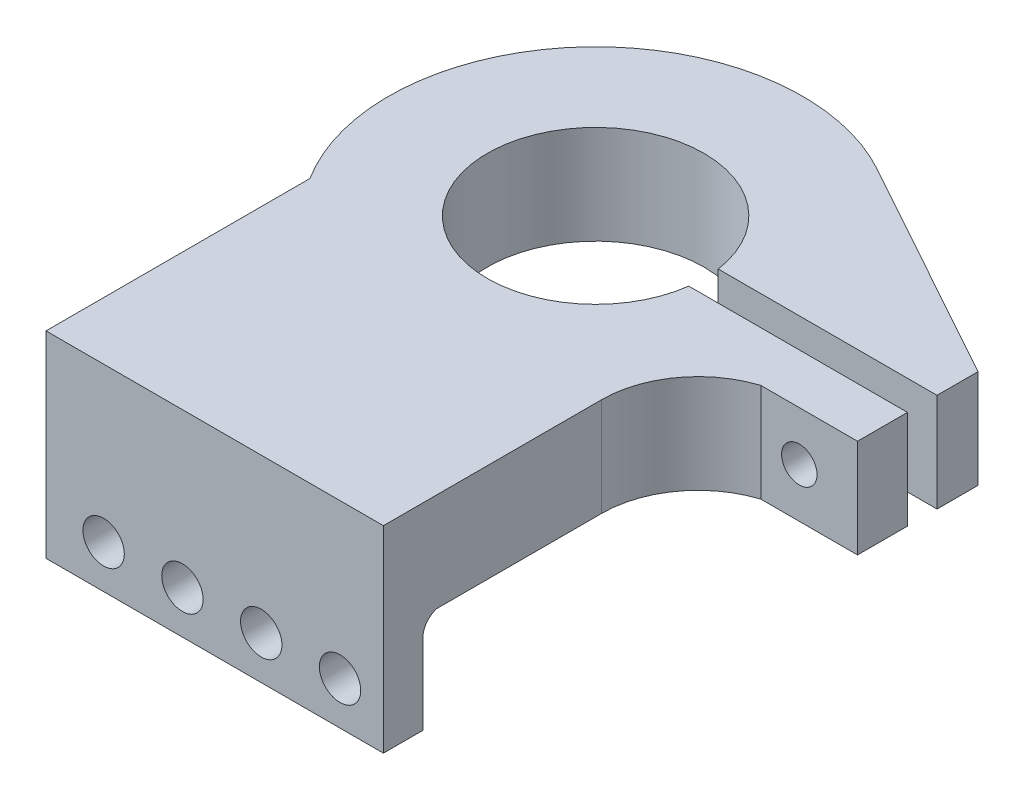
from build123d import *

# Parameters (mm, degrees)
SKETCH_1_R                       = 27
SKETCH_1_R_2                     = 11
EXTRUDE_1_DEPTH                  = 10
SKETCH_2_W                       = 22.095017754
SKETCH_2_H                       = 3
CUT_EXTRUDE_5_DEPTH              = 10
EXTRUDE_6_DEPTH                  = 10
EXTRUDE_7_DEPTH                  = 10
SKETCH_5_W                       = 10
SKETCH_5_H                       = 31.875888506
CUT_EXTRUDE_6_DEPTH              = 10
EXTRUDE_8_DEPTH                  = 10
SKETCH_7_R                       = 1.8
CUT_EXTRUDE_7_DEPTH              = 25
SKETCH_9_R                       = 3
CUT_EXTRUDE_8_DEPTH              = 25
SKETCH_10_R                      = 3
SKETCH_10_R_2                    = 1.8
EXTRUDE_9_DEPTH                  = 10
SKETCH_11_W                      = 6.352022703
SKETCH_11_H                      = 3
CUT_EXTRUDE_9_DEPTH              = 10
CUT_EXTRUDE_START                = -10
CUT_EXTRUDE_11_DEPTH             = 10
SKETCH_19_W                      = 12.590596853
SKETCH_19_H                      = 36.443103769
EXTRUDE_10_DEPTH                 = 10
CUT_EXTRUDE_16_DEPTH             = 45.4
SKETCH_23_W                      = 4
SKETCH_23_H                      = 10
EXTRUDE_14_DEPTH                 = 45.5
CUT_EXTRUDE_17_DEPTH             = 45.5
EXTRUDE_15_DEPTH                 = 45.5
SKETCH_26_W                      = 0.328740034
SKETCH_26_H                      = 1.346185816
CUT_EXTRUDE_18_DEPTH             = 45.5
SKETCH_28_R                      = 2.5
CUT_EXTRUDE_19_DEPTH             = 45.5
SKETCH_30_R                      = 1.8
CUT_EXTRUDE_21_DEPTH             = 45.5
SKETCH_31_R                      = 2.5
EXTRUDE_16_DEPTH                 = 10
CUT_EXTRUDE_23_DEPTH             = 10
CUT_EXTRUDE_23_DEPTH_BACK        = 10
CUT_EXTRUDE_24_DEPTH             = 10
CUT_EXTRUDE_25_DEPTH             = 10
SKETCH_35_R                      = 2.5
CUT_EXTRUDE_26_DEPTH             = 10
CUT_EXTRUDE_28_REACH             = 55.82
CUT_EXTRUDE_28_DIRECTION_2_DEPTH = 10
EXTRUDE_17_DEPTH                 = 10
EXTRUDE_18_DEPTH                 = 35
SKETCH_41_W                      = 10.589604426
SKETCH_41_H                      = 19.03102185
CUT_EXTRUDE_29_DEPTH             = 8
EXTRUDE_19_DEPTH                 = 10
CUT_EXTRUDE_30_DEPTH             = 10
SKETCH_44_W                      = 12.06182449
SKETCH_44_H                      = 13.548079332
CUT_EXTRUDE_31_DEPTH             = 10
EXTRUDE_20_DEPTH                 = 10
SKETCH_46_R                      = 1.8
CUT_EXTRUDE_33_DEPTH             = 27
SKETCH_48_R                      = 4
CUT_EXTRUDE_34_DEPTH             = 27
SKETCH_49_W                      = 13.336731655
SKETCH_49_H                      = 10
EXTRUDE_21_DEPTH                 = 2
CUT_EXTRUDE_35_DEPTH             = 14
SKETCH_53_R                      = 4
SKETCH_53_R_2                    = 1.8
EXTRUDE_22_DEPTH                 = 4
SKETCH_54_W                      = 11.097852062
SKETCH_54_H                      = 3
CUT_EXTRUDE_36_DEPTH             = 11
SKETCH_55_R                      = 1.8
CUT_EXTRUDE_37_DEPTH             = 10
SKETCH_56_R                      = 2.5
EXTRUDE_23_DEPTH                 = 0.5
SKETCH_57_R                      = 2.1
CUT_EXTRUDE_38_DEPTH             = 10


with BuildPart() as part:
    # 草圖1 → 填料-伸長1 (new body)
    with BuildSketch(Plane(origin=(0, 0, 0), x_dir=(1, 0, 0), z_dir=(0, 1, 0))):
        with Locations(Location((0, 0, 0), (0, 0, 270))):
            Circle(SKETCH_1_R)
        with Locations(Location((0, 0, 0), (0, 0, 270))):
            Circle(SKETCH_1_R_2, mode=Mode.SUBTRACT)
    extrude(amount=EXTRUDE_1_DEPTH)

    # 草圖2 → 除料-伸長5 (cut)
    with BuildSketch(Plane(origin=(0, 10, 0), x_dir=(1, 0, 0), z_dir=(0, 1, 0))):
        with Locations((19.801751301, 0.053075405)):
            Rectangle(SKETCH_2_W, SKETCH_2_H)
    extrude(amount=-CUT_EXTRUDE_5_DEPTH, mode=Mode.SUBTRACT)

    # 草圖3 → 填料-伸長6 (add)
    with BuildSketch(Plane(origin=(0, 10, 0), x_dir=(1, 0, 0), z_dir=(0, 1, 0))):
        Polygon((26.955295524, 1.553075405), (36.774942479, 1.553075405), (36.774942479, 6.233042813), (16.156778885, 21.632348371), align=None)
    extrude(amount=-EXTRUDE_6_DEPTH)

    # 草圖4 → 填料-伸長7 (add)
    with BuildSketch(Plane(origin=(0, 10, 0), x_dir=(1, 0, 0), z_dir=(0, 1, 0))):
        Polygon((26.961201925, -1.446924595), (36.771201925, -1.446924595), (36.771201925, -38.002813101), (-26.958798075, -38.002813101), (-27, 0), (-10.999869528, -0.053575877), (-10.999869528, -22.141468438), (17.239278233, -20.779973195), align=None)
    extrude(amount=-EXTRUDE_7_DEPTH)

    # 草圖5 → 除料-伸長6 (cut)
    with BuildSketch(Plane(origin=(0, 10, 0), x_dir=(1, 0, 0), z_dir=(0, 1, 0))):
        with Locations((31.771201925, -22.064868848)):
            Rectangle(SKETCH_5_W, SKETCH_5_H)
    extrude(amount=-CUT_EXTRUDE_6_DEPTH, mode=Mode.SUBTRACT)

    # 草圖6 → 填料-伸長8 (add)
    with BuildSketch(Plane(origin=(0, 10, 0), x_dir=(1, 0, 0), z_dir=(0, 1, 0))):
        with BuildLine():
            Line((28.570335935, -6.126924595), (26.771201925, -6.126924595))
            Line((26.771201925, -6.126924595), (26.771201925, -8.915002743))
            ThreePointArc((26.771201925, -8.915002743), (27.260031865, -7.255916929), (28.570335935, -6.126924595))
        make_face()
    extrude(amount=-EXTRUDE_8_DEPTH)

    # 草圖7 → 除料-伸長7 (cut)
    with BuildSketch(Plane.XY.offset(6.126924595)):
        with Locations((31.771201925, 5)):
            Circle(SKETCH_7_R)
    extrude(amount=-CUT_EXTRUDE_7_DEPTH, mode=Mode.SUBTRACT)

    # 草圖9 → 除料-伸長8 (cut)
    with BuildSketch(Plane.XY.offset(6.126924595)):
        with Locations((31.771201925, 5)):
            Circle(SKETCH_9_R)
    extrude(amount=-CUT_EXTRUDE_8_DEPTH, mode=Mode.SUBTRACT)

    # 草圖10 → 填料-伸長9 (add)
    with BuildSketch(Plane.XY.offset(6.126924595)):
        with Locations((31.771201925, 5)):
            Circle(SKETCH_10_R)
        with Locations((31.771201925, 5)):
            Circle(SKETCH_10_R_2, mode=Mode.SUBTRACT)
    extrude(amount=-EXTRUDE_9_DEPTH)

    # 草圖11 → 除料-伸長9 (cut)
    with BuildSketch(Plane(origin=(0, 10, 0), x_dir=(1, 0, 0), z_dir=(0, 1, 0))):
        with Locations((31.710814777, 0.053075405)):
            Rectangle(SKETCH_11_W, SKETCH_11_H)
    extrude(amount=-CUT_EXTRUDE_9_DEPTH, mode=Mode.SUBTRACT)

    # 草圖12 → 除料-伸長11 (cut)
    with BuildSketch(Plane(origin=(0, 10, 0), x_dir=(1, 0, 0), z_dir=(0, 1, 0)).offset(CUT_EXTRUDE_START)):
        with BuildLine():
            Line((-26.958798075, -1.916110557), (-26.958798075, -38.002813101))
            Line((-26.958798075, -38.002813101), (-22.958798075, -38.002813101))
            Line((-22.958798075, -38.002813101), (-22.958798075, -14.208926452))
            ThreePointArc((-22.958798075, -14.208926452), (-25.691425872, -8.303652008), (-26.931923814, -1.916110557))
            Line((-26.931923814, -1.916110557), (-26.958798075, -1.916110557))
        make_face()
    extrude(amount=CUT_EXTRUDE_11_DEPTH, mode=Mode.SUBTRACT)

    # 草圖19 → 填料-伸長10 (add)
    with BuildSketch(Plane(origin=(0, 10, 0), x_dir=(1, 0, 0), z_dir=(0, 1, 0))):
        with Locations((-20.703010567, -19.781261216)):
            Rectangle(SKETCH_19_W, SKETCH_19_H)
    extrude(amount=-EXTRUDE_10_DEPTH)

    # 草圖20 → 除料-伸長16 (cut)
    with BuildSketch(Plane(origin=(0, 10, 0), x_dir=(1, 0, 0), z_dir=(0, 1, 0))):
        with BuildLine():
            Line((-29.650037287, -38.002813101), (-26.998308993, -38.002813101))
            Line((-26.998308993, -38.002813101), (-26.998308993, -1.559709332))
            Line((-26.998308993, -1.559709332), (-26.999389481, -0.563115103))
            ThreePointArc((-26.999389481, -0.563115103), (-27.003472798, -0.310785854), (-27.005197962, -0.058429465))
            Line((-27.005197962, -0.058429465), (-29.650037287, 0))
            Line((-29.650037287, 0), (-29.650037287, -38.002813101))
        make_face()
        with BuildLine():
            Line((-26.998308993, -38.002813101), (-18.650037287, -38.002813101))
            Line((-18.650037287, -38.002813101), (-18.650037287, -19.531007147))
            ThreePointArc((-18.650037287, -19.531007147), (-24.716649717, -10.87986019), (-26.999389481, -0.563115103))
            Line((-26.999389481, -0.563115103), (-26.998308993, -1.559709332))
            Line((-26.998308993, -1.559709332), (-26.998308993, -38.002813101))
        make_face()
    extrude(amount=-CUT_EXTRUDE_16_DEPTH, mode=Mode.SUBTRACT)

    # 草圖23 → 填料-伸長14 (add)
    with BuildSketch(Plane(origin=(26.771201925, 0, 0), x_dir=(0, 0, -1), z_dir=(1, 0, 0))):
        with Locations((-36.002813101, -5)):
            Rectangle(SKETCH_23_W, SKETCH_23_H)
    extrude(amount=-EXTRUDE_14_DEPTH)

    # 草圖24 → 除料-伸長17 (cut)
    with BuildSketch(Plane(origin=(0, 10, 0), x_dir=(1, 0, 0), z_dir=(0, 1, 0))):
        with BuildLine():
            Line((-22.875040088, -38.002813101), (-18.650037287, -38.002813101))
            Line((-18.650037287, -38.002813101), (-18.650037287, -19.531007147))
            ThreePointArc((-18.650037287, -19.531007147), (-19.783571885, -18.381904538), (-20.846430488, -17.167133333))
            Line((-20.846430488, -17.167133333), (-22.875040088, -17.167133333))
            Line((-22.875040088, -17.167133333), (-22.875040088, -38.002813101))
        make_face()
    extrude(amount=-CUT_EXTRUDE_17_DEPTH, mode=Mode.SUBTRACT)

    # 草圖25 → 填料-伸長15 (add)
    with BuildSketch(Plane(origin=(26.771201925, 0, 0), x_dir=(0, 0, -1), z_dir=(1, 0, 0))):
        with BuildLine():
            Line((-34.002813101, 0), (-34.002813101, -1.291959452))
            ThreePointArc((-34.002813101, -1.291959452), (-33.541813444, -0.371252566), (-32.58140031, 0))
            Line((-32.58140031, 0), (-34.002813101, 0))
        make_face()
    extrude(amount=-EXTRUDE_15_DEPTH)

    # 草圖26 → 除料-伸長18 (cut)
    with BuildSketch(Plane.XY.offset(38.002813101)):
        with Locations((-18.814407304, -0.673092908)):
            Rectangle(SKETCH_26_W, SKETCH_26_H)
    extrude(amount=-CUT_EXTRUDE_18_DEPTH, mode=Mode.SUBTRACT)

    # 草圖28 → 除料-伸長19 (cut)
    with BuildSketch(Plane(origin=(0, 10, 0), x_dir=(1, 0, 0), z_dir=(0, 1, 0))):
        with Locations(Location((0, 19.568388114, 0), (0, 0, 270))):
            Circle(SKETCH_28_R)
        with Locations(Location((10, 17.068388114, 0), (0, 0, 270))):
            Circle(SKETCH_28_R)
        with Locations(Location((-10.003691547, 17.068388114, 0), (0, 0, 270))):
            Circle(SKETCH_28_R)
        with Locations(Location((-18.488688393, 0, 0), (0, 0, 270))):
            Circle(SKETCH_28_R)
        with Locations(Location((-15.988688393, 10.029350154, 0), (0, 0, 270))):
            Circle(SKETCH_28_R)
        with Locations(Location((-15.988688393, -10.054369158, 0), (0, 0, 270))):
            Circle(SKETCH_28_R)
        with Locations(Location((15.383048832, 10.029350154, 0), (0, 0, 270))):
            Circle(SKETCH_28_R)
    extrude(amount=-CUT_EXTRUDE_19_DEPTH, mode=Mode.SUBTRACT)

    # 草圖30 → 除料-伸長21 (cut)
    with BuildSketch(Plane(origin=(0, 0, 34.002813101), x_dir=(-1, 0, 0), z_dir=(0, 0, -1))):
        with Locations((3.939417681, -5.645979726)):
            Circle(SKETCH_30_R)
        with Locations((-4.060582319, -5.645979726)):
            Circle(SKETCH_30_R)
        with Locations((-12.060582319, -5.645979726)):
            Circle(SKETCH_30_R)
        with Locations((-20.060582319, -5.645979726)):
            Circle(SKETCH_30_R)
        with Locations((11.939417681, -5.645979726)):
            Circle(SKETCH_30_R)
    extrude(amount=-CUT_EXTRUDE_21_DEPTH, mode=Mode.SUBTRACT)

    # 草圖31 → 填料-伸長16 (add)
    with BuildSketch(Plane(origin=(0, 10, 0), x_dir=(1, 0, 0), z_dir=(0, 1, 0))):
        with Locations((-18.488688393, 0)):
            Circle(SKETCH_31_R)
        with Locations((-15.988688393, 10.029350154)):
            Circle(SKETCH_31_R)
        with Locations((15.383048832, 10.029350154)):
            Circle(SKETCH_31_R)
        with Locations((10, 17.068388114)):
            Circle(SKETCH_31_R)
        with Locations((0, 19.568388114)):
            Circle(SKETCH_31_R)
        with Locations((-15.988688393, -10.054369158)):
            Circle(SKETCH_31_R)
        with Locations((-10.003691547, 17.068388114)):
            Circle(SKETCH_31_R)
    extrude(amount=-EXTRUDE_16_DEPTH)

    # 草圖32 → 除料-伸長23 (cut, two sides: drawn at the far end of the back side and taken through both)
    with BuildSketch(Plane(origin=(0, 0, 0), x_dir=(-1, 0, 0), z_dir=(0, -1, 0)).offset(-CUT_EXTRUDE_23_DEPTH_BACK)):
        Polygon((7.786853888, -32.58140031), (7.786853888, -19.531007147), (18.650037287, -19.531007147), (18.650037287, -32.58140031), (18.650037287, -42.504836079), (7.786853888, -42.504836079), align=None)
    extrude(amount=CUT_EXTRUDE_23_DEPTH + CUT_EXTRUDE_23_DEPTH_BACK, mode=Mode.SUBTRACT)

    # 草圖33 → 除料-伸長24 (cut)
    with BuildSketch(Plane(origin=(0, 0, 0), x_dir=(-1, 0, 0), z_dir=(0, -1, 0))):
        with BuildLine():
            Line((-14.357219189, 15.361171531), (-21.139696125, 22.617924405))
            Line((-21.139696125, 22.617924405), (1.281017386, 36.775323206))
            Line((1.281017386, 36.775323206), (35.703109951, 9.003834991))
            Line((35.703109951, 9.003834991), (17.752702844, -25.274837626))
            Line((17.752702844, -25.274837626), (7.786853888, -19.531007147))
            ThreePointArc((7.786853888, -19.531007147), (17.752702844, 11.266626619), (-14.357219189, 15.361171531))
        make_face()
    extrude(amount=-CUT_EXTRUDE_24_DEPTH, mode=Mode.SUBTRACT)

    # 草圖34 → 除料-伸長25 (cut)
    with BuildSketch(Plane(origin=(0, 0, 0), x_dir=(-1, 0, 0), z_dir=(0, -1, 0))):
        Polygon((-14.357219189, 15.361171531), (-36.774942479, 6.233042813), (-37.276444093, 15.861092082), (-16.552485282, 23.300431357), align=None)
    extrude(amount=-CUT_EXTRUDE_25_DEPTH, mode=Mode.SUBTRACT)

    # 草圖35 → 除料-伸長26 (cut)
    with BuildSketch(Plane(origin=(0, 0, 0), x_dir=(-1, 0, 0), z_dir=(0, -1, 0))):
        with Locations(Location((-11.341233129, 11.341233129, 0), (0, 0, 90))):
            Circle(SKETCH_35_R)
        with Locations(Location((0, 16.038925705, 0), (0, 0, 90))):
            Circle(SKETCH_35_R)
        with Locations(Location((11.341233129, 11.341233129, 0), (0, 0, 90))):
            Circle(SKETCH_35_R)
        with Locations(Location((16.038925705, 0, 0), (0, 0, 90))):
            Circle(SKETCH_35_R)
        with Locations(Location((11.341233129, -11.341233129, 0), (0, 0, 90))):
            Circle(SKETCH_35_R)
        with Locations(Location((0, -16.038925705, 0), (0, 0, 90))):
            Circle(SKETCH_35_R)
        with Locations(Location((-11.341233129, -11.341233129, 0), (0, 0, 90))):
            Circle(SKETCH_35_R)
    extrude(amount=-CUT_EXTRUDE_26_DEPTH, mode=Mode.SUBTRACT)

    # 除料-伸長28: up to this face of the body (flat: up to its plane)
    cut_extrude_28_end = Plane(part.part.faces().sort_by_distance((9.492174018, -10, 36.002813101))[0])
    # 草圖36 → 除料-伸長28 (cut, up to the picked face)
    with BuildSketch(Plane(origin=(0, 0, 0), x_dir=(-1, 0, 0), z_dir=(0, -1, 0)), mode=Mode.PRIVATE) as cut_extrude_28_sk1:
        with BuildLine():
            Line((-29.245777926, -32.58140031), (-26.771201925, -32.58140031))
            Line((-26.771201925, -32.58140031), (-26.771201925, -8.915002743))
            ThreePointArc((-26.771201925, -8.915002743), (-27.260031865, -7.255916929), (-28.570335935, -6.126924595))
            Line((-28.570335935, -6.126924595), (-36.771201925, -6.126924595))
            Line((-36.771201925, -6.126924595), (-36.771201925, -32.58140031))
            Line((-36.771201925, -32.58140031), (-29.245777926, -32.58140031))
        make_face()
    cut_extrude_28_tool1 = split(extrude(cut_extrude_28_sk1.sketch, amount=CUT_EXTRUDE_28_REACH, mode=Mode.PRIVATE), bisect_by=cut_extrude_28_end, keep=Keep.BOTH, mode=Mode.PRIVATE)
    # 草圖36 → 除料-伸長28 (cut, up to the picked face)
    with BuildSketch(Plane(origin=(0, 0, 0), x_dir=(-1, 0, 0), z_dir=(0, -1, 0)), mode=Mode.PRIVATE) as cut_extrude_28_sk2:
        with BuildLine():
            Line((-26.771201925, -32.58140031), (-16.46148187, -32.58140031))
            Line((-16.46148187, -32.58140031), (-16.46148187, -15.840070304))
            ThreePointArc((-16.46148187, -15.840070304), (-19.326611723, -8.923034955), (-26.243647071, -6.057905103))
            Line((-26.243647071, -6.057905103), (-36.771201925, -6.057905103))
            Line((-36.771201925, -6.057905103), (-36.771201925, -6.126924595))
            Line((-36.771201925, -6.126924595), (-28.570335935, -6.126924595))
            ThreePointArc((-28.570335935, -6.126924595), (-27.260031865, -7.255916929), (-26.771201925, -8.915002743))
            Line((-26.771201925, -8.915002743), (-26.771201925, -32.58140031))
        make_face()
    cut_extrude_28_tool2 = split(extrude(cut_extrude_28_sk2.sketch, amount=CUT_EXTRUDE_28_REACH, mode=Mode.PRIVATE), bisect_by=cut_extrude_28_end, keep=Keep.BOTH, mode=Mode.PRIVATE)
    # 草圖36 → 除料-伸長28 (cut, up to the picked face)
    with BuildSketch(Plane(origin=(0, 0, 0), x_dir=(-1, 0, 0), z_dir=(0, -1, 0)), mode=Mode.PRIVATE) as cut_extrude_28_sk3:
        Polygon((-16.46148187, -48.732099881), (-16.46148187, -32.58140031), (-26.771201925, -32.58140031), (-29.245777926, -32.58140031), (-29.245777926, -48.732099881), align=None)
    cut_extrude_28_tool3 = split(extrude(cut_extrude_28_sk3.sketch, amount=CUT_EXTRUDE_28_REACH, mode=Mode.PRIVATE), bisect_by=cut_extrude_28_end, keep=Keep.BOTH, mode=Mode.PRIVATE)
    add(cut_extrude_28_tool1.solids().sort_by(Axis((31.795312, 0, 19.42147), (0, -1, 0)))[0], mode=Mode.SUBTRACT)
    add(cut_extrude_28_tool2.solids().sort_by(Axis((21.914175, 0, 20.106567), (0, -1, 0)))[0], mode=Mode.SUBTRACT)
    add(cut_extrude_28_tool3.solids().sort_by(Axis((22.85363, 0, 40.65675), (0, -1, 0)))[0], mode=Mode.SUBTRACT)

    # 草圖36 → 除料-伸長28 direction 2 (cut)
    with BuildSketch(Plane(origin=(0, 0, 0), x_dir=(-1, 0, 0), z_dir=(0, -1, 0))):
        with BuildLine():
            Line((-29.245777926, -32.58140031), (-26.771201925, -32.58140031))
            Line((-26.771201925, -32.58140031), (-26.771201925, -8.915002743))
            ThreePointArc((-26.771201925, -8.915002743), (-27.260031865, -7.255916929), (-28.570335935, -6.126924595))
            Line((-28.570335935, -6.126924595), (-36.771201925, -6.126924595))
            Line((-36.771201925, -6.126924595), (-36.771201925, -32.58140031))
            Line((-36.771201925, -32.58140031), (-29.245777926, -32.58140031))
        make_face()
        with BuildLine():
            Line((-26.771201925, -32.58140031), (-16.46148187, -32.58140031))
            Line((-16.46148187, -32.58140031), (-16.46148187, -15.840070304))
            ThreePointArc((-16.46148187, -15.840070304), (-19.326611723, -8.923034955), (-26.243647071, -6.057905103))
            Line((-26.243647071, -6.057905103), (-36.771201925, -6.057905103))
            Line((-36.771201925, -6.057905103), (-36.771201925, -6.126924595))
            Line((-36.771201925, -6.126924595), (-28.570335935, -6.126924595))
            ThreePointArc((-28.570335935, -6.126924595), (-27.260031865, -7.255916929), (-26.771201925, -8.915002743))
            Line((-26.771201925, -8.915002743), (-26.771201925, -32.58140031))
        make_face()
        Polygon((-16.46148187, -48.732099881), (-16.46148187, -32.58140031), (-26.771201925, -32.58140031), (-29.245777926, -32.58140031), (-29.245777926, -48.732099881), align=None)
    extrude(amount=-CUT_EXTRUDE_28_DIRECTION_2_DEPTH, mode=Mode.SUBTRACT)

    # 草圖38 → 填料-伸長17 (add)
    with BuildSketch(Plane.ZY.offset(7.786853888)):
        with BuildLine():
            Line((19.531007147, 0), (19.531007147, 10))
            Line((19.531007147, 10), (38.002813101, 10))
            Line((38.002813101, 10), (38.002813101, -10))
            Line((38.002813101, -10), (34.002813101, -10))
            Line((34.002813101, -10), (34.002813101, -1.291959452))
            ThreePointArc((34.002813101, -1.291959452), (33.577903495, -0.331546319), (32.58140031, 0))
            Line((32.58140031, 0), (19.531007147, 0))
        make_face()
    extrude(amount=EXTRUDE_17_DEPTH)

    # 草圖40 → 填料-伸長18 (add)
    with BuildSketch(Plane.ZY.offset(17.786853888)):
        with BuildLine():
            Line((34.002813101, -1.888956522), (37.181733072, -1.888956522))
            Line((37.181733072, -1.888956522), (35.37419013, 3.598878428))
            Line((35.37419013, 3.598878428), (31.081694561, 2.185047629))
            Line((31.081694561, 2.185047629), (32.58140031, 0))
            ThreePointArc((32.58140031, 0), (33.607766756, -0.706948584), (34.002813101, -1.888956522))
        make_face()
    extrude(amount=-EXTRUDE_18_DEPTH)

    # 草圖41 → 除料-伸長29 (cut)
    with BuildSketch(Plane(origin=(16.46148187, 0, 0), x_dir=(0, 0, -1), z_dir=(1, 0, 0))):
        with Locations((-32.708010888, -1.746915748)):
            Rectangle(SKETCH_41_W, SKETCH_41_H)
    extrude(amount=CUT_EXTRUDE_29_DEPTH, mode=Mode.SUBTRACT)

    # 草圖42 → 填料-伸長19 (add)
    with BuildSketch(Plane(origin=(0, 0, 0), x_dir=(-1, 0, 0), z_dir=(0, -1, 0))):
        Polygon((17.786853888, -19.531007147), (17.786853888, -11.212634053), (7.786853888, -19.531007147), align=None)
    extrude(amount=-EXTRUDE_19_DEPTH)

    # 草圖43 → 除料-伸長30 (cut)
    with BuildSketch(Plane(origin=(0, 10, 0), x_dir=(1, 0, 0), z_dir=(0, 1, 0)).offset(CUT_EXTRUDE_START)):
        with BuildLine():
            Line((19.990592639, -6.517019226), (36.771201925, -6.517019226))
            Line((36.771201925, -6.517019226), (36.771201925, -1.446924595))
            Line((36.771201925, -1.446924595), (36.774942479, 6.233042813))
            Line((36.774942479, 6.233042813), (14.357219189, 15.361171531))
            ThreePointArc((14.357219189, 15.361171531), (20.361897064, 5.24294589), (19.990592639, -6.517019226))
        make_face()
    extrude(amount=CUT_EXTRUDE_30_DEPTH, mode=Mode.SUBTRACT)


with BuildPart() as cut_extrude_30_piece_1:
    # of the separate pieces the step leaves, piece 1, a body of its own (cut_extrude_30_pieces)
    add(part.part.solids().sort_by_distance((20.968626336, 0, -1.553075405))[0])

    # 草圖45 → 填料-伸長20 (add)
    with BuildSketch(Plane(origin=(0, 10, 0), x_dir=(1, 0, 0), z_dir=(0, 1, 0))):
        with BuildLine():
            Line((31.100125668, 6.819712429), (10.181146705, 18.396727574))
            ThreePointArc((10.181146705, 18.396727574), (17.706051077, 11.339801097), (20.968626336, 1.553075405))
            Line((20.968626336, 1.553075405), (31.100125668, 1.553075405))
            Line((31.100125668, 1.553075405), (31.100125668, 6.819712429))
        make_face()
        with BuildLine():
            ThreePointArc((20.976218507, -1.446924595), (20.639679474, -4.01235154), (19.990592639, -6.517019226))
            Line((19.990592639, -6.517019226), (23.281979531, -6.517019226))
            Line((23.281979531, -6.517019226), (31.100125668, -6.517019226))
            Line((31.100125668, -6.517019226), (31.100125668, -1.446924595))
            Line((31.100125668, -1.446924595), (20.976218507, -1.446924595))
        make_face()
    extrude(amount=-EXTRUDE_20_DEPTH)

    # 草圖46 → 除料-伸長33 (cut)
    with BuildSketch(Plane.XY.offset(6.517019226)):
        with Locations((27.191052599, 5)):
            Circle(SKETCH_46_R)
    extrude(amount=-CUT_EXTRUDE_33_DEPTH, mode=Mode.SUBTRACT)

    # 草圖48 → 除料-伸長34 (cut)
    with BuildSketch(Plane.XY.offset(-1.553075405)):
        with Locations((27.191052599, 5)):
            Circle(SKETCH_48_R)
    extrude(amount=-CUT_EXTRUDE_34_DEPTH, mode=Mode.SUBTRACT)

    # 草圖49 → 填料-伸長21 (add)
    with BuildSketch(Plane(origin=(31.100125668, 0, 0), x_dir=(0, 0, -1), z_dir=(1, 0, 0))):
        with Locations((0.151346602, 5)):
            Rectangle(SKETCH_49_W, SKETCH_49_H)
    extrude(amount=EXTRUDE_21_DEPTH)

    # 草圖52 → 除料-伸長35 (cut)
    with BuildSketch(Plane(origin=(0, 0, 0), x_dir=(-1, 0, 0), z_dir=(0, -1, 0))):
        Polygon((-29.338824592, 7.794454517), (-33.295122994, 5.604953461), (-33.295122994, 7.794454517), align=None)
        Polygon((-31.100125668, 1.553075405), (-34.213503752, 1.553075405), (-36.130944669, -1.446924595), (-31.100125668, -1.446924595), align=None)
    extrude(amount=-CUT_EXTRUDE_35_DEPTH, mode=Mode.SUBTRACT)

    # 草圖53 → 填料-伸長22 (add)
    with BuildSketch(Plane(origin=(0, 0, 1.446924595), x_dir=(-1, 0, 0), z_dir=(0, 0, -1))):
        with Locations(Location((-27.191052599, 5, 0), (0, 0, 180))):
            Circle(SKETCH_53_R)
        with Locations(Location((-27.191052599, 5, 0), (0, 0, 180))):
            Circle(SKETCH_53_R_2, mode=Mode.SUBTRACT)
    extrude(amount=EXTRUDE_22_DEPTH)

    # 草圖54 → 除料-伸長36 (cut)
    with BuildSketch(Plane(origin=(0, 0, 0), x_dir=(-1, 0, 0), z_dir=(0, -1, 0))):
        with Locations((-27.551199637, 0.053075405)):
            Rectangle(SKETCH_54_W, SKETCH_54_H)
    extrude(amount=-CUT_EXTRUDE_36_DEPTH, mode=Mode.SUBTRACT)

    # 草圖55 → 除料-伸長37 (cut)
    with BuildSketch(Plane(origin=(0, 0, 34.002813101), x_dir=(-1, 0, 0), z_dir=(0, 0, -1))):
        with Locations((11.939417681, -5.645979726)):
            Circle(SKETCH_55_R)
    extrude(amount=-CUT_EXTRUDE_37_DEPTH, mode=Mode.SUBTRACT)

    # 草圖56 → 填料-伸長23 (add)
    with BuildSketch(Plane(origin=(0, 10, 0), x_dir=(1, 0, 0), z_dir=(0, 1, 0))):
        with Locations(Location((11.341233129, 11.341233129, 0), (0, 0, 90))):
            Circle(SKETCH_56_R)
        with Locations(Location((11.341233129, -11.341233129, 0), (0, 0, 90))):
            Circle(SKETCH_56_R)
        with Locations(Location((0, -16.038925705, 0), (0, 0, 90))):
            Circle(SKETCH_56_R)
        with Locations(Location((-11.341233129, -11.341233129, 0), (0, 0, 90))):
            Circle(SKETCH_56_R)
        with Locations(Location((-16.038925705, 0, 0), (0, 0, 90))):
            Circle(SKETCH_56_R)
        with Locations(Location((-11.341233129, 11.341233129, 0), (0, 0, 90))):
            Circle(SKETCH_56_R)
        with Locations(Location((0, 16.038925705, 0), (0, 0, 90))):
            Circle(SKETCH_56_R)
    extrude(amount=-EXTRUDE_23_DEPTH)

    # 草圖57 → 除料-伸長38 (cut)
    with BuildSketch(Plane(origin=(0, 0, 34.002813101), x_dir=(-1, 0, 0), z_dir=(0, 0, -1))):
        with Locations((11.939417681, -5.645979726)):
            Circle(SKETCH_57_R)
        with Locations((3.939417681, -5.645979726)):
            Circle(SKETCH_57_R)
        with Locations((-4.060582319, -5.645979726)):
            Circle(SKETCH_57_R)
        with Locations((-12.060582319, -5.645979726)):
            Circle(SKETCH_57_R)
    extrude(amount=-CUT_EXTRUDE_38_DEPTH, mode=Mode.SUBTRACT)


with BuildPart() as cut_extrude_30_piece_2:
    # of the separate pieces the step leaves, piece 2, a body of its own (cut_extrude_30_pieces)
    add(part.part.solids().sort_by_distance((36.774942479, 0, -1.553075405))[0])

    # 草圖44 → 除料-伸長31 (cut)
    with BuildSketch(Plane(origin=(36.774942479, 0, 0), x_dir=(0, 0, -1), z_dir=(1, 0, 0))):
        with Locations((4.709924578, 4.853858474)):
            Rectangle(SKETCH_44_W, SKETCH_44_H)
    extrude(amount=-CUT_EXTRUDE_31_DEPTH, mode=Mode.SUBTRACT)


solid = cut_extrude_30_piece_1.part
